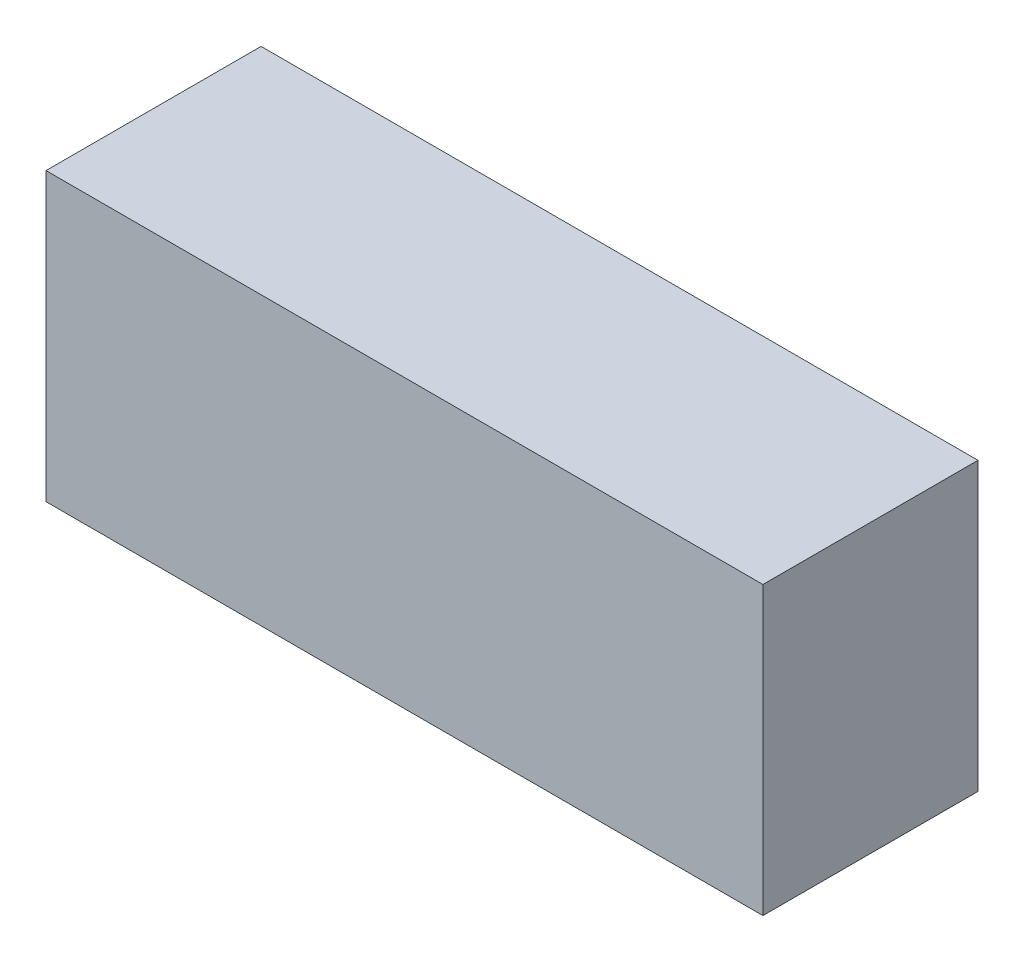
from build123d import *

# Parameters (mm, degrees)
SKETCH1_W           = 100
SKETCH1_H           = 30
BOSS_EXTRUDE1_DEPTH = 20


with BuildPart() as part:
    # Sketch1 → Boss-Extrude1 (new, symmetric)
    with BuildSketch(Plane(origin=(0, 0, 0), x_dir=(1, 0, 0), z_dir=(0, 1, 0))):
        Rectangle(SKETCH1_W, SKETCH1_H)
    extrude(amount=BOSS_EXTRUDE1_DEPTH, both=True)


solid = part.part
